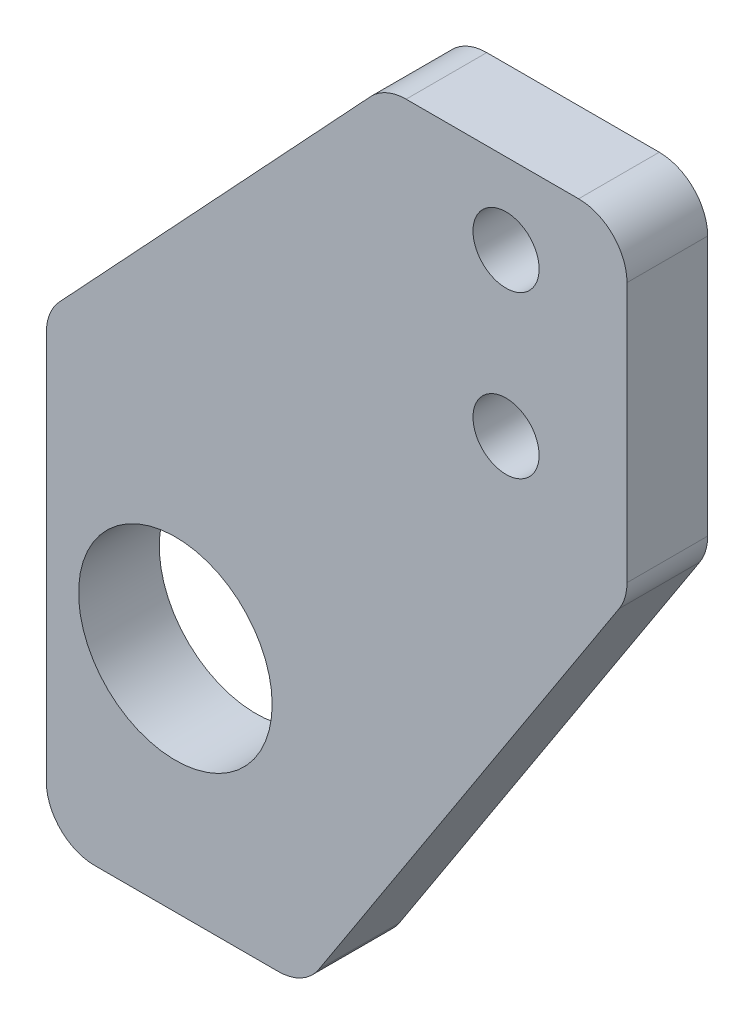
from build123d import *

# Parameters (mm, degrees)
SKETCH_1_R      = 6
SKETCH_1_R_2    = 2.05
EXTRUDE_1_DEPTH = 5
FILLET_1_R      = 3


with BuildPart() as part:
    # ｽｹｯﾁ1 → ﾎﾞｽ - 押し出し1 (new body)
    with BuildSketch(Plane.XY):
        Polygon((-36, 0), (-20, 0), (0, 30.8), (0, 50.8), (-15, 50.8), (-36, 28.3), align=None)
        with Locations((-28, 14.15)):
            Circle(SKETCH_1_R, mode=Mode.SUBTRACT)
        with Locations((-7.5, 35.8)):
            Circle(SKETCH_1_R_2, mode=Mode.SUBTRACT)
        with Locations((-7.5, 45.8)):
            Circle(SKETCH_1_R_2, mode=Mode.SUBTRACT)
    extrude(amount=EXTRUDE_1_DEPTH)

    # ﾌｨﾚｯﾄ1
    fillet_1_edges = [part.edges().sort_by_distance(p)[0] for p in [
        (-15, 50.8, 2.5),
        (0, 50.8, 2.5),
        (0, 30.8, 2.5),
        (-20, 0, 2.5),
        (-36, 0, 2.5),
        (-36, 28.3, 2.5),
    ]]
    fillet(fillet_1_edges, radius=FILLET_1_R)


solid = part.part
